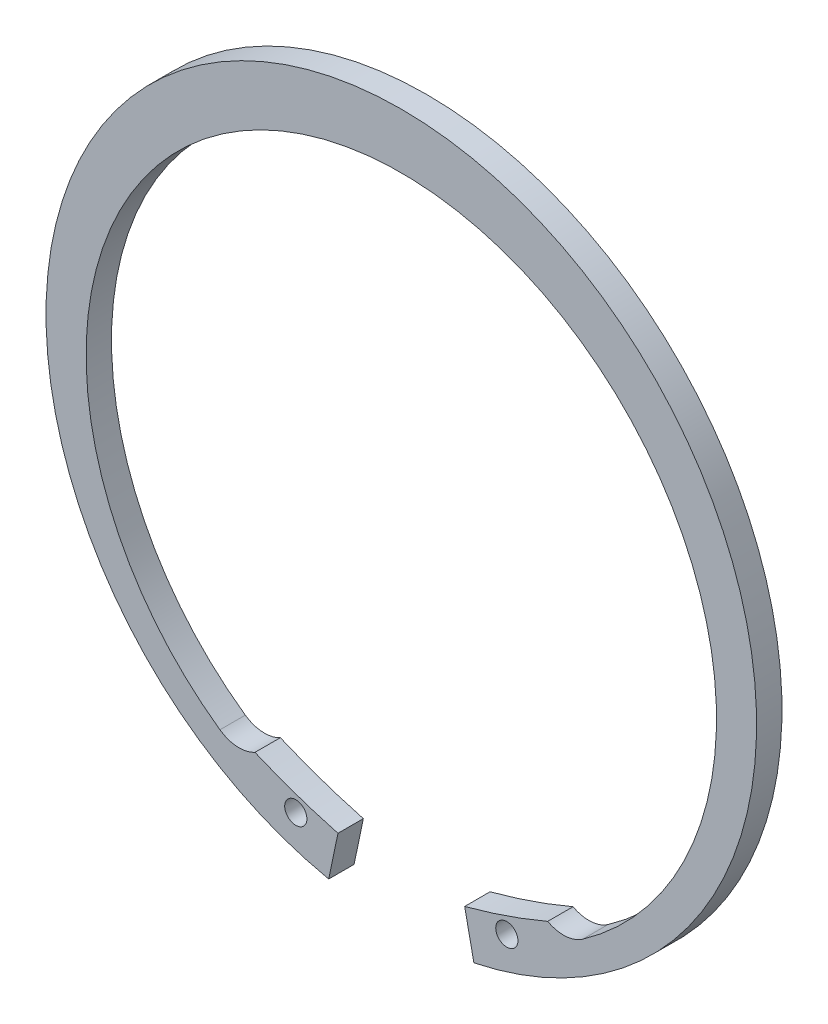
from build123d import *

# Parameters (mm, degrees)
BOSS_EXTRUDE1_DEPTH      = 2
BOSS_EXTRUDE1_DEPTH_BACK = 2
SKETCH3_R                = 1.75
CUT_EXTRUDE2_DEPTH       = 80.221209281


with BuildPart() as part:
    # Sketch3 → Boss-Extrude1 (new, two sides: drawn at the far end of the back side and taken through both)
    with BuildSketch(Plane.XY.offset(-BOSS_EXTRUDE1_DEPTH_BACK)):
        with BuildLine():
            Line((-11.440860215, -54.818853669), (-9.985215054, -47.844133447))
            Line((-9.985215054, -47.844133447), (-23.069216943, -43.342064897))
            ThreePointArc((-23.069216943, -43.342064897), (-25.874137738, -43.964725959), (-28.586767, -43.017662099))
            ThreePointArc((-28.586767, -43.017662099), (0, 47.3), (28.586767, -43.017662099))
            ThreePointArc((28.586767, -43.017662099), (25.874137738, -43.964725959), (23.069216943, -43.342064897))
            Line((23.069216943, -43.342064897), (9.985215054, -47.844133447))
            Line((9.985215054, -47.844133447), (11.440860215, -54.818853669))
            ThreePointArc((11.440860215, -54.818853669), (0, 56), (-11.440860215, -54.818853669))
        make_face()
        with Locations((-16.631028749, -48.333429201)):
            Circle(SKETCH3_R, mode=Mode.SUBTRACT)
        with Locations(Location((16.631028749, -48.333429201, 0), (0, 0, 180))):
            Circle(SKETCH3_R, mode=Mode.SUBTRACT)
    extrude(amount=BOSS_EXTRUDE1_DEPTH + BOSS_EXTRUDE1_DEPTH_BACK)

    # Sketch5 → Cut-Extrude2 (cut, symmetric)
    with BuildSketch(Plane.XY):
        with BuildLine():
            Line((-23.069216943, -43.342064897), (0, 0))
            Line((0, 0), (-9.985215054, -47.844133447))
            ThreePointArc((-9.985215054, -47.844133447), (-16.608557726, -45.829496133), (-23.069216943, -43.342064897))
        make_face()
    cut_extrude2 = extrude(amount=CUT_EXTRUDE2_DEPTH, both=True, mode=Mode.SUBTRACT)

    # Mirror1: Cut-Extrude2 across plane
    add(cut_extrude2.mirror(Plane(origin=(0, 0, 0), x_dir=(0, 0, 1), z_dir=(1, 0, 0))), mode=Mode.SUBTRACT)


solid = part.part
